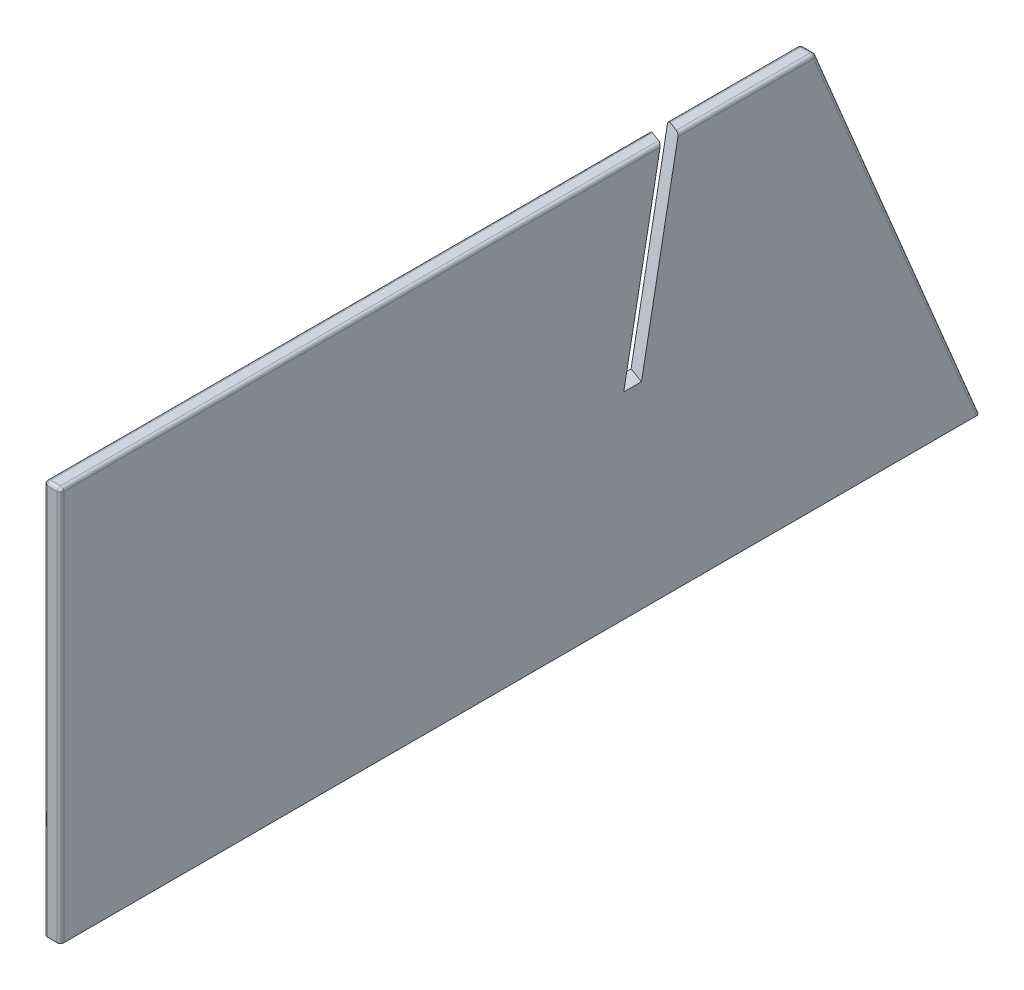
from build123d import *

# Parameters (mm, degrees)
BOSS_EXTRUDE2_DEPTH = 12.7
CUT_EXTRUDE1_DEPTH  = 778.596755789
FILLET1_R           = 2.54


with BuildPart() as part:
    # Sketch1 → Boss-Extrude2 (new body)
    with BuildSketch(Plane(origin=(0, 0, 0), x_dir=(0, 0, -1), z_dir=(1, 0, 0))):
        Polygon((584.2, 304.8), (0, 304.8), (0, 0), (711.2, 0), align=None)
    extrude(amount=BOSS_EXTRUDE2_DEPTH)

    # Sketch3 → Cut-Extrude1 (cut, through all)
    with BuildSketch(Plane(origin=(11.214382214, 0, 4.081701322), x_dir=(0, 1, 0), z_dir=(0.9396926207859083, 0, 0.34202014332566943))):
        Polygon((304.8, -453.495658666), (152.4, -426.623426806), (152.4, -413.727508835), (304.8, -440.599740695), align=None)
    extrude(amount=-CUT_EXTRUDE1_DEPTH, mode=Mode.SUBTRACT)

    # Fillet1
    fillet1_edges = [part.edges().sort_by_distance(p)[0] for p in [
        (6.35, 304.8, -584.2),
        (12.7, 304.8, -531.088788946),
        (0, 304.8, -533.399999933),
        (12.7, 152.4, -647.7),
        (0, 152.4, -647.7),
        (0, 152.4, 0),
        (12.7, 152.4, 0),
        (6.35, 304.8, 0),
        (12.7, 304.8, -232.127014316),
        (0, 304.8, -234.438225303),
    ]]
    fillet(fillet1_edges, radius=FILLET1_R)


solid = part.part
